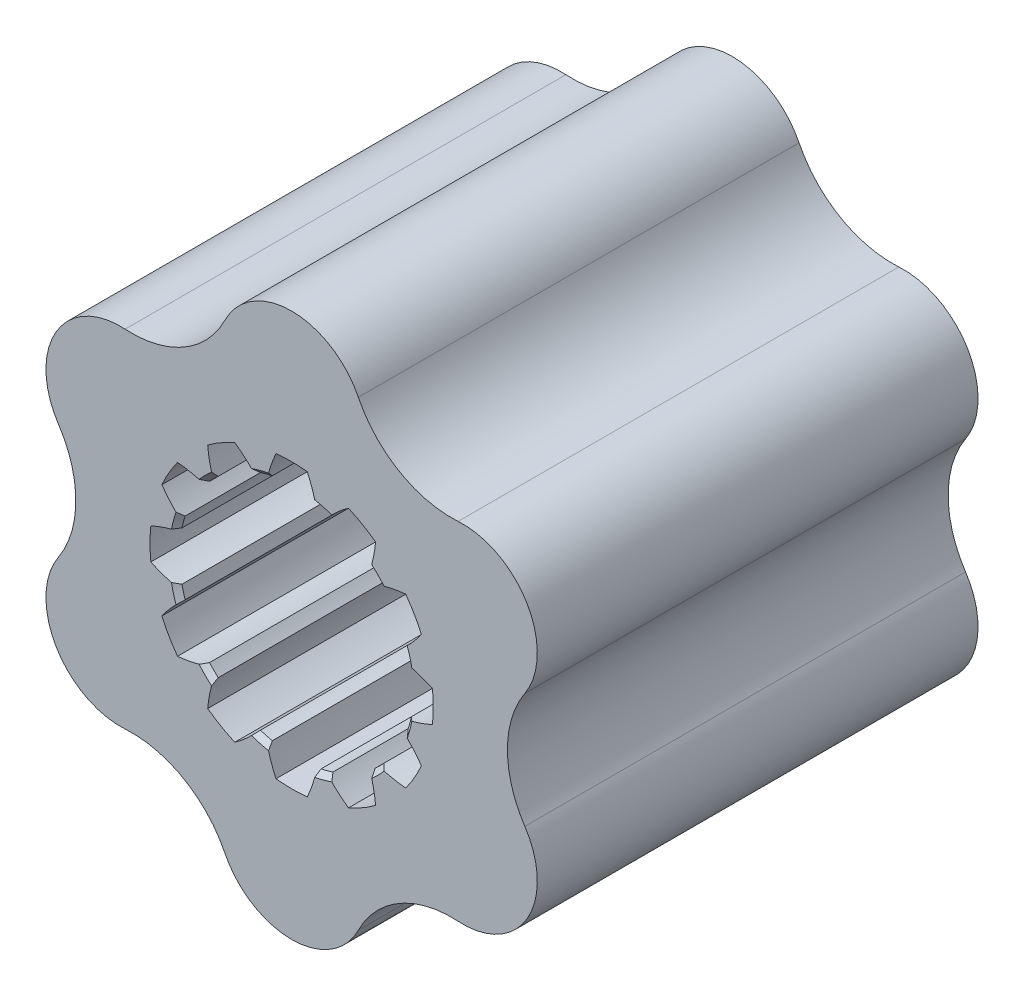
from build123d import *

# Parameters (mm, degrees)
SKETCH1_R         = 11.5
EXTRUDE1_DEPTH    = 43.4
EXTRUDE2_REACH    = 58.454
CIRPATTERN1_COUNT = 12


with BuildPart() as part:
    # Sketch1 → Extrude1 (new body)
    with BuildSketch(Plane.XY):
        with BuildLine():
            ThreePointArc((6.569682115, 22.724006281), (0, 26.8), (-6.569682115, 22.724006281))
            ThreePointArc((-6.569682115, 22.724006281), (-10.625, 18.40303983), (-16.394725658, 17.051514747))
            ThreePointArc((-16.394725658, 17.051514747), (-23.209480821, 13.4), (-22.964407773, 5.672491534))
            ThreePointArc((-22.964407773, 5.672491534), (-21.25, 0), (-22.964407773, -5.672491534))
            ThreePointArc((-22.964407773, -5.672491534), (-23.209480821, -13.4), (-16.394725658, -17.051514747))
            ThreePointArc((-16.394725658, -17.051514747), (-10.625, -18.40303983), (-6.569682115, -22.724006281))
            ThreePointArc((-6.569682115, -22.724006281), (0, -26.8), (6.569682115, -22.724006281))
            ThreePointArc((6.569682115, -22.724006281), (10.625, -18.40303983), (16.394725658, -17.051514747))
            ThreePointArc((16.394725658, -17.051514747), (23.209480821, -13.4), (22.964407773, -5.672491534))
            ThreePointArc((22.964407773, -5.672491534), (21.25, 0), (22.964407773, 5.672491534))
            ThreePointArc((22.964407773, 5.672491534), (23.209480821, 13.4), (16.394725658, 17.051514747))
            ThreePointArc((16.394725658, 17.051514747), (10.625, 18.40303983), (6.569682115, 22.724006281))
        make_face()
        Circle(SKETCH1_R, mode=Mode.SUBTRACT)
    extrude(amount=EXTRUDE1_DEPTH)

    # Sketch4 → Cut-Revolve1 (revolve, cut)
    with BuildSketch(Plane(origin=(0, 0, 0), x_dir=(0, 0, -1), z_dir=(1, 0, 0)), mode=Mode.PRIVATE) as cut_revolve1_sk:
        Polygon((0, 0), (-43.4, 0), (-43.4, 12.05), (-42.9, 11.55), (-0.5, 11.55), (0, 12.05), align=None)
    revolve(cut_revolve1_sk.sketch.rotate(Axis((0, 0, 0), (0, 0, 1)), 90), axis=Axis((0, 0, 0), (0, 0, 1)), mode=Mode.SUBTRACT)

    # Sketch2 → Extrude2 (cut, up to next)
    with BuildSketch(Plane(origin=(0, 0, 0), x_dir=(-1, 0, 0), z_dir=(0, 0, -1)), mode=Mode.PRIVATE) as extrude2_sk1:
        with BuildLine():
            ThreePointArc((1.54, 13.864735843), (0, 13.95), (-1.54, 13.864735843))
            ThreePointArc((-1.54, 13.864735843), (-2.042378597, 12.605566852), (-2.4, 11.297898035))
            ThreePointArc((-2.4, 11.297898035), (0, 11.55), (2.4, 11.297898035))
            ThreePointArc((2.4, 11.297898035), (2.042378597, 12.605566852), (1.54, 13.864735843))
        make_face()
    extrude2_tool1 = extrude(extrude2_sk1.sketch, amount=-EXTRUDE2_REACH, mode=Mode.PRIVATE) & part.part
    extrude2 = extrude2_tool1.solids().sort_by_distance((0, 12.606446, 0))[0]
    add(extrude2, mode=Mode.SUBTRACT)

    # CirPattern1: Extrude2 ×12 about axis
    cirpattern1_axis = Axis((0, 0, 0), (0, 0, 1))
    for i in range(1, CIRPATTERN1_COUNT):
        add(extrude2.rotate(cirpattern1_axis, i * 360 / CIRPATTERN1_COUNT), mode=Mode.SUBTRACT)


solid = part.part
